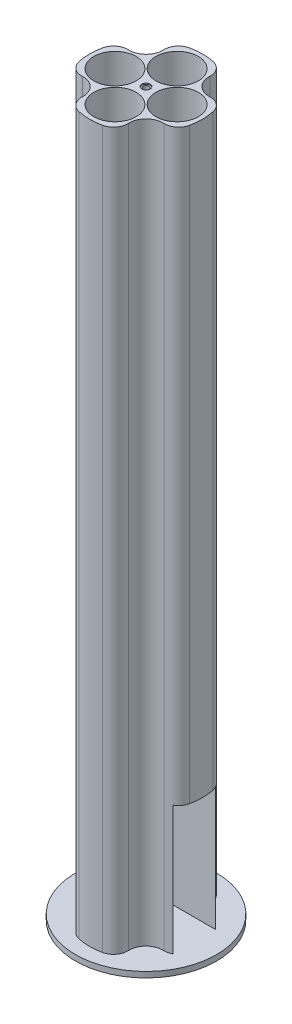
from build123d import *
from build123d.topology import SkipClean

# Parameters (mm, degrees)
SKETCH1_R           = 100
BOSS_EXTRUDE2_DEPTH = 1120
SKETCH4_R           = 37.5
CUT_EXTRUDE1_DEPTH  = 1100
SKETCH6_R           = 30.030042901
CUT_EXTRUDE2_DEPTH  = 1129.893263334
SKETCH7_R           = 5
CUT_EXTRUDE3_DEPTH  = 1200
FILLET1_R           = 25
SKETCH8_W           = 276.180333513
SKETCH8_H           = 316.248560879
CUT_EXTRUDE4_DEPTH  = 65
SKETCH9_R           = 7.5
CUT_EXTRUDE5_DEPTH  = 2
BOSS_EXTRUDE3_START = 223.21458
BOSS_EXTRUDE3_DEPTH = 223.21458
SKETCH11_R          = 125
BOSS_EXTRUDE4_DEPTH = 10
SKETCH12_W          = 75
SKETCH12_H          = 228.21458
CUT_EXTRUDE6_DEPTH  = 123


with BuildPart() as part:
    # Sketch1 → Boss-Extrude2 (new body)
    with BuildSketch(Plane(origin=(0, 0, 0), x_dir=(1, 0, 0), z_dir=(0, 1, 0))):
        with Locations(Location((0, 0, 0), (0, 0, 270))):
            Circle(SKETCH1_R)
    extrude(amount=BOSS_EXTRUDE2_DEPTH)

    # Sketch4 → Cut-Extrude1 (cut)
    with BuildSketch(Plane(origin=(0, 1120, 0), x_dir=(1, 0, 0), z_dir=(0, 1, 0))):
        with Locations(Location((55, 0, 0), (0, 0, 270))):
            Circle(SKETCH4_R)
        with Locations(Location((0, 55, 0), (0, 0, 270))):
            Circle(SKETCH4_R)
        with Locations(Location((-55, 0, 0), (0, 0, 270))):
            Circle(SKETCH4_R)
        with Locations(Location((0, -55, 0), (0, 0, 270))):
            Circle(SKETCH4_R)
    extrude(amount=-CUT_EXTRUDE1_DEPTH, mode=Mode.SUBTRACT)

    # Sketch6 → Cut-Extrude2 (cut, through all)
    with BuildSketch(Plane(origin=(0, 1120, 0), x_dir=(1, 0, 0), z_dir=(0, 1, 0))):
        with Locations((-70.710678119, 70.710678119)):
            Circle(SKETCH6_R)
        with Locations((70.710678119, 70.710678119)):
            Circle(SKETCH6_R)
        with Locations((70.710678119, -70.710678119)):
            Circle(SKETCH6_R)
        with Locations((-70.710678119, -70.710678119)):
            Circle(SKETCH6_R)
    extrude(amount=-CUT_EXTRUDE2_DEPTH, mode=Mode.SUBTRACT)

    # Sketch7 → Cut-Extrude3 (cut)
    with BuildSketch(Plane(origin=(0, 1120, 0), x_dir=(1, 0, 0), z_dir=(0, 1, 0))):
        with Locations(Location((0, 0, 0), (0, 0, 270))):
            Circle(SKETCH7_R)
    extrude(amount=-CUT_EXTRUDE3_DEPTH, mode=Mode.SUBTRACT)

    # Fillet1
    fillet1_edges = [part.edges().sort_by_distance(p)[0] for p in [
        (-46.528605162, 560, 88.51603754),
        (-88.51603754, 560, 46.528605162),
        (88.51603754, 560, 46.528605162),
        (46.528605162, 560, 88.51603754),
        (46.528605162, 560, -88.51603754),
        (88.51603754, 560, -46.528605162),
        (-88.51603754, 560, -46.528605162),
        (-46.528605162, 560, -88.51603754),
    ]]
    fillet(fillet1_edges, radius=FILLET1_R)

    # Sketch8 → Cut-Extrude4 (cut)
    with BuildSketch(Plane(origin=(0, 1120, 0), x_dir=(1, 0, 0), z_dir=(0, 1, 0))):
        with Locations((9.785456368, -2.918303702)):
            Rectangle(SKETCH8_W, SKETCH8_H)
    extrude(amount=-CUT_EXTRUDE4_DEPTH, mode=Mode.SUBTRACT)

    # Sketch9 → Cut-Extrude5 (cut)
    with BuildSketch(Plane(origin=(0, 1055, 0), x_dir=(1, 0, 0), z_dir=(0, 1, 0))):
        with Locations(Location((0, 0, 0), (0, 0, 270))):
            Circle(SKETCH9_R)
    extrude(amount=-CUT_EXTRUDE5_DEPTH, mode=Mode.SUBTRACT)

    # Sketch10 → Boss-Extrude3 (add)
    with SkipClean():  # the faces are left unmerged after this step: merging them gives an invalid solid
        with BuildSketch(Plane.XZ.offset(BOSS_EXTRUDE3_START)):
            with BuildLine():
                ThreePointArc((20.990620884, 97.772152656), (0, 100), (-20.990620884, 97.772152656))
                ThreePointArc((-20.990620884, 97.772152656), (-35.556079582, 88.575114519), (-40.71464911, 72.139565913))
                ThreePointArc((-40.71464911, 72.139565913), (-49.476231144, 49.476231144), (-72.139565913, 40.71464911))
                ThreePointArc((-72.139565913, 40.71464911), (-88.575114519, 35.556079582), (-97.772152656, 20.990620884))
                ThreePointArc((-97.772152656, 20.990620884), (-100, 0), (-97.772152656, -20.990620884))
                ThreePointArc((-97.772152656, -20.990620884), (-88.575114519, -35.556079582), (-72.139565913, -40.71464911))
                ThreePointArc((-72.139565913, -40.71464911), (-49.476231144, -49.476231144), (-40.71464911, -72.139565913))
                ThreePointArc((-40.71464911, -72.139565913), (-35.556079582, -88.575114519), (-20.990620884, -97.772152656))
                ThreePointArc((-20.990620884, -97.772152656), (0, -100), (20.990620884, -97.772152656))
                ThreePointArc((20.990620884, -97.772152656), (35.556079582, -88.575114519), (40.71464911, -72.139565913))
                ThreePointArc((40.71464911, -72.139565913), (49.476231144, -49.476231144), (72.139565913, -40.71464911))
                ThreePointArc((72.139565913, -40.71464911), (88.575114519, -35.556079582), (97.772152656, -20.990620884))
                ThreePointArc((97.772152656, -20.990620884), (100, 0), (97.772152656, 20.990620884))
                ThreePointArc((97.772152656, 20.990620884), (88.575114519, 35.556079582), (72.139565913, 40.71464911))
                ThreePointArc((72.139565913, 40.71464911), (49.476231144, 49.476231144), (40.71464911, 72.139565913))
                ThreePointArc((40.71464911, 72.139565913), (35.556079582, 88.575114519), (20.990620884, 97.772152656))
            make_face()
        extrude(amount=-BOSS_EXTRUDE3_DEPTH)

    # Sketch11 → Boss-Extrude4 (add)
    with SkipClean():  # the faces are left unmerged after this step: merging them gives an invalid solid
        with BuildSketch(Plane.XZ.offset(223.21458)):
            with Locations(Location((0, 0, 0), (0, 0, 270))):
                Circle(SKETCH11_R)
        extrude(amount=-BOSS_EXTRUDE4_DEPTH)

    # Sketch12 → Cut-Extrude6 (cut, symmetric)
    with SkipClean():  # the faces are left unmerged after this step: merging them gives an invalid solid
        with BuildSketch(Plane(origin=(0, 0, 0), x_dir=(0, 0, -1), z_dir=(1, 0, 0))):
            with Locations((0, -99.10729)):
                Rectangle(SKETCH12_W, SKETCH12_H)
        extrude(amount=CUT_EXTRUDE6_DEPTH, both=True, mode=Mode.SUBTRACT)


solid = part.part
